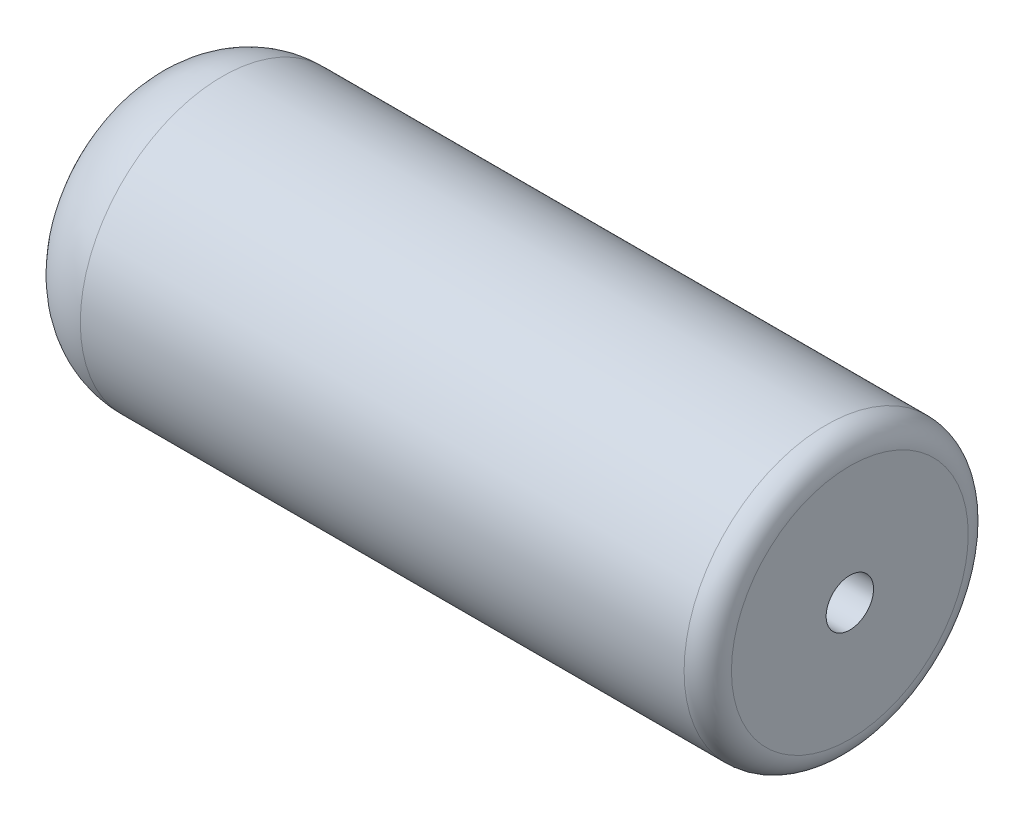
from build123d import *

# Parameters (mm, degrees)
SKETCH2_R           = 15.24
BOSS_EXTRUDE2_DEPTH = 76.2
SKETCH3_R           = 2.54
CUT_EXTRUDE1_DEPTH  = 63.5
FILLET1_R           = 8.89
FILLET2_R           = 2.54


with BuildPart() as part:
    # Sketch2 → Boss-Extrude2 (new body)
    with BuildSketch(Plane(origin=(0, 0, 0), x_dir=(0, 0, -1), z_dir=(1, 0, 0))):
        with Locations(Location((0, 0, 0), (0, 0, 180))):
            Circle(SKETCH2_R)
    extrude(amount=BOSS_EXTRUDE2_DEPTH)

    # Sketch3 → Cut-Extrude1 (cut)
    with BuildSketch(Plane(origin=(76.2, 0, 0), x_dir=(0, 0, -1), z_dir=(1, 0, 0))):
        Circle(SKETCH3_R)
    extrude(amount=-CUT_EXTRUDE1_DEPTH, mode=Mode.SUBTRACT)

    # Fillet1
    fillet1_edges = [part.edges().sort_by_distance(p)[0] for p in [
        (0, 0, -15.24),
    ]]
    fillet(fillet1_edges, radius=FILLET1_R)

    # Fillet2
    fillet2_edges = [part.edges().sort_by_distance(p)[0] for p in [
        (76.2, 0, -15.24),
    ]]
    fillet(fillet2_edges, radius=FILLET2_R)


solid = part.part
